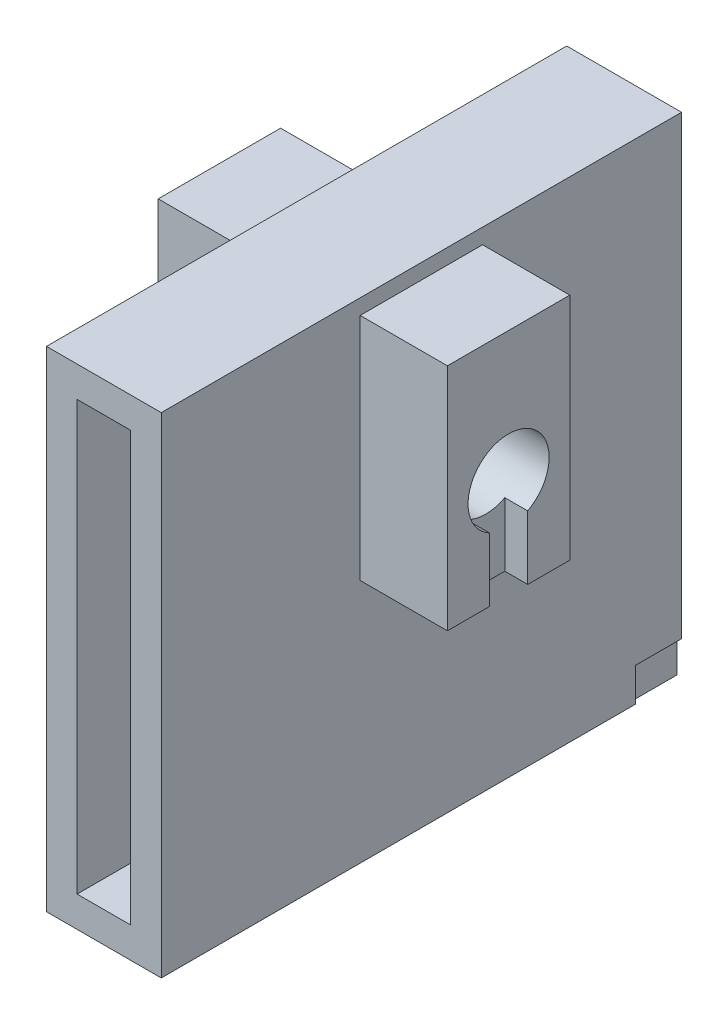
from build123d import *

# Parameters (mm, degrees)
SKETCH_1_W           = 34
SKETCH_1_H           = 32
EXTRUDE_1_DEPTH      = 7.5
SKETCH_2_W           = 3.5
SKETCH_2_H           = 28
CUT_EXTRUDE_1_DEPTH  = 34
SKETCH_3_W           = 4.4
SKETCH_3_H           = 11
CUT_EXTRUDE_2_DEPTH  = 45.949358405
SKETCH_5_W           = 8
SKETCH_5_H           = 15
EXTRUDE_2_DEPTH      = 5.7
SKETCH_7_W           = 8
SKETCH_7_H           = 15
EXTRUDE_3_DEPTH      = 5.7
SKETCH_9_R           = 2.65
CUT_EXTRUDE_5_DEPTH  = 49.180959113
SKETCH_13_W          = 2.8
SKETCH_13_H          = 4.315717283
CUT_EXTRUDE_6_DEPTH  = 1.5
SKETCH_14_W          = 2.5
SKETCH_14_H          = 4.377857335
CUT_EXTRUDE_7_DEPTH  = 1.5
SKETCH_15_W          = 2
SKETCH_15_H          = 0.201258068
CUT_EXTRUDE_8_DEPTH  = 3
SKETCH_16_W          = 3.003569047
SKETCH_16_H          = 2
CUT_EXTRUDE_9_DEPTH  = 0.3
SKETCH_17_W          = 3
SKETCH_17_H          = 2
CUT_EXTRUDE_10_DEPTH = 0.3


with BuildPart() as part:
    # Эскиз1 → Бобышка-Вытянуть1 (new body)
    with BuildSketch(Plane(origin=(0, 0, 0), x_dir=(0, 0, -1), z_dir=(1, 0, 0))):
        with Locations((23.807859897, 1.28911194)):
            Rectangle(SKETCH_1_W, SKETCH_1_H)
    extrude(amount=EXTRUDE_1_DEPTH)

    # Эскиз2 → Вырез-Вытянуть1 (cut)
    with BuildSketch(Plane(origin=(0, 0, -40.807859897), x_dir=(-1, 0, 0), z_dir=(0, 0, -1))):
        with Locations((-3.75, 1.28911194)):
            Rectangle(SKETCH_2_W, SKETCH_2_H)
    extrude(amount=-CUT_EXTRUDE_1_DEPTH, mode=Mode.SUBTRACT)

    # Эскиз3 → Вырез-Вытянуть2 (cut, through all)
    with BuildSketch(Plane(origin=(7.5, 0, 0), x_dir=(0, 0, -1), z_dir=(1, 0, 0))):
        with Locations((23.807859897, 8.78911194)):
            Rectangle(SKETCH_3_W, SKETCH_3_H)
    extrude(amount=-CUT_EXTRUDE_2_DEPTH, mode=Mode.SUBTRACT)


with BuildPart() as body_2:
    # Эскиз5 → Бобышка-Вытянуть2 (new body)
    with BuildSketch(Plane(origin=(7.5, 0, 0), x_dir=(0, 0, -1), z_dir=(1, 0, 0))):
        with Locations((23.807859897, 8.78911194)):
            Rectangle(SKETCH_5_W, SKETCH_5_H)
    extrude(amount=EXTRUDE_2_DEPTH)


with BuildPart() as body_3:
    # Эскиз7 → Бобышка-Вытянуть3 (new body)
    with BuildSketch(Plane.ZY):
        with Locations((-23.807859897, 8.78911194)):
            Rectangle(SKETCH_7_W, SKETCH_7_H)
    extrude(amount=EXTRUDE_3_DEPTH)


with BuildPart() as cut_extrude_5_tool:
    # Эскиз9 → Вырез-Вытянуть5 (new, through all)
    with BuildSketch(Plane(origin=(13.2, 0, 0), x_dir=(0, 0, -1), z_dir=(1, 0, 0))):
        with Locations((23.807859897, 7.78911194)):
            Circle(SKETCH_9_R)
    extrude(amount=-CUT_EXTRUDE_5_DEPTH)


with BuildPart() as part_1:
    add(part.part)

    # Вырез-Вытянуть5: cut by cut_extrude_5_tool
    add(cut_extrude_5_tool.part, mode=Mode.SUBTRACT)

    # Эскиз15 → Вырез-Вытянуть8 (cut)
    with BuildSketch(Plane(origin=(0, 0, -40.807859897), x_dir=(-1, 0, 0), z_dir=(0, 0, -1))):
        with Locations((-6.5, -12.610259026)):
            Rectangle(SKETCH_15_W, SKETCH_15_H)
        with Locations((-1, -12.610259026)):
            Rectangle(SKETCH_15_W, SKETCH_15_H)
    extrude(amount=-CUT_EXTRUDE_8_DEPTH, mode=Mode.SUBTRACT)

    # Эскиз16 → Вырез-Вытянуть9 (cut)
    with BuildSketch(Plane.ZY):
        with Locations((-39.306075374, -13.71088806)):
            Rectangle(SKETCH_16_W, SKETCH_16_H)
    extrude(amount=-CUT_EXTRUDE_9_DEPTH, mode=Mode.SUBTRACT)

    # Эскиз17 → Вырез-Вытянуть10 (cut)
    with BuildSketch(Plane(origin=(7.5, 0, 0), x_dir=(0, 0, -1), z_dir=(1, 0, 0))):
        with Locations((39.307859897, -13.71088806)):
            Rectangle(SKETCH_17_W, SKETCH_17_H)
    extrude(amount=-CUT_EXTRUDE_10_DEPTH, mode=Mode.SUBTRACT)


with BuildPart() as body_2_1:
    add(body_2.part)

    # Вырез-Вытянуть5: cut by cut_extrude_5_tool
    add(cut_extrude_5_tool.part, mode=Mode.SUBTRACT)

    # Эскиз14 → Вырез-Вытянуть7 (cut)
    with BuildSketch(Plane(origin=(13.2, 0, 0), x_dir=(0, 0, -1), z_dir=(1, 0, 0))):
        with Locations((23.807859897, 3.343648644)):
            Rectangle(SKETCH_14_W, SKETCH_14_H)
    extrude(amount=-CUT_EXTRUDE_7_DEPTH, mode=Mode.SUBTRACT)


with BuildPart() as body_3_1:
    add(body_3.part)

    # Вырез-Вытянуть5: cut by cut_extrude_5_tool
    add(cut_extrude_5_tool.part, mode=Mode.SUBTRACT)

    # Эскиз13 → Вырез-Вытянуть6 (cut)
    with BuildSketch(Plane.ZY.offset(5.7)):
        with Locations((-23.807859897, 3.393235991)):
            Rectangle(SKETCH_13_W, SKETCH_13_H)
    extrude(amount=-CUT_EXTRUDE_6_DEPTH, mode=Mode.SUBTRACT)


solid = Compound([part_1.part, body_2_1.part, body_3_1.part])
